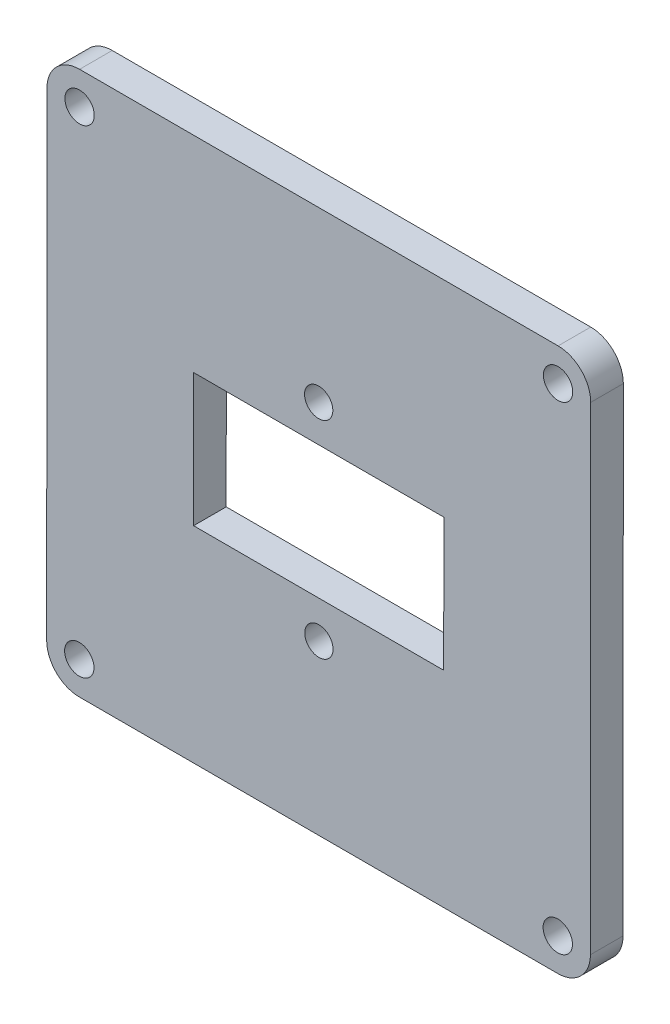
from build123d import *

# Parameters (mm, degrees)
SKETCH_1_R      = 1.35
SKETCH_1_R_2    = 1.3
EXTRUDE_1_DEPTH = 3


with BuildPart() as part:
    # 草图1 → 凸台-拉伸1 (new body)
    with BuildSketch(Plane.XY.offset(3)):
        with BuildLine():
            Line((291.111009591, 60.850346254), (291.08477602, 16.850708535))
            ThreePointArc((291.08477602, 16.850708535), (291.962190742, 14.728864681), (294.08298682, 13.848920402))
            Line((294.08298682, 13.848920402), (338.082927985, 13.82268665))
            ThreePointArc((338.082927985, 13.82268665), (340.20477184, 14.700101372), (341.084716119, 16.82089745))
            Line((341.084716119, 16.82089745), (341.11094969, 60.820535169))
            ThreePointArc((341.11094969, 60.820535169), (340.233534968, 62.942379024), (338.11273889, 63.822323303))
            Line((338.11273889, 63.822323303), (294.112797724, 63.848557054))
            ThreePointArc((294.112797724, 63.848557054), (291.990953869, 62.971142333), (291.111009591, 60.850346254))
        make_face()
        with Locations(Location((338.084716652, 16.822686117, 0), (0, 0, 180))):
            Circle(SKETCH_1_R, mode=Mode.SUBTRACT)
        with Locations(Location((294.111009057, 60.848557587, 0), (0, 0, 180))):
            Circle(SKETCH_1_R, mode=Mode.SUBTRACT)
        with Locations(Location((338.110950223, 60.822323836, 0), (0, 0, 180))):
            Circle(SKETCH_1_R, mode=Mode.SUBTRACT)
        with Locations(Location((294.084775487, 16.848919869, 0), (0, 0, 180))):
            Circle(SKETCH_1_R, mode=Mode.SUBTRACT)
        with Locations(Location((316.118760947, 29.316353397, 0), (0, 0, 180))):
            Circle(SKETCH_1_R_2, mode=Mode.SUBTRACT)
        with Locations(Location((316.098042718, 48.316807582, 0), (0, 0, 180))):
            Circle(SKETCH_1_R_2, mode=Mode.SUBTRACT)
        Polygon((304.601683778, 44.942477784), (327.602382744, 44.928764251), (327.595108581, 32.728346323), (304.594409616, 32.742059855), align=None, mode=Mode.SUBTRACT)
    extrude(amount=-EXTRUDE_1_DEPTH)


solid = part.part
